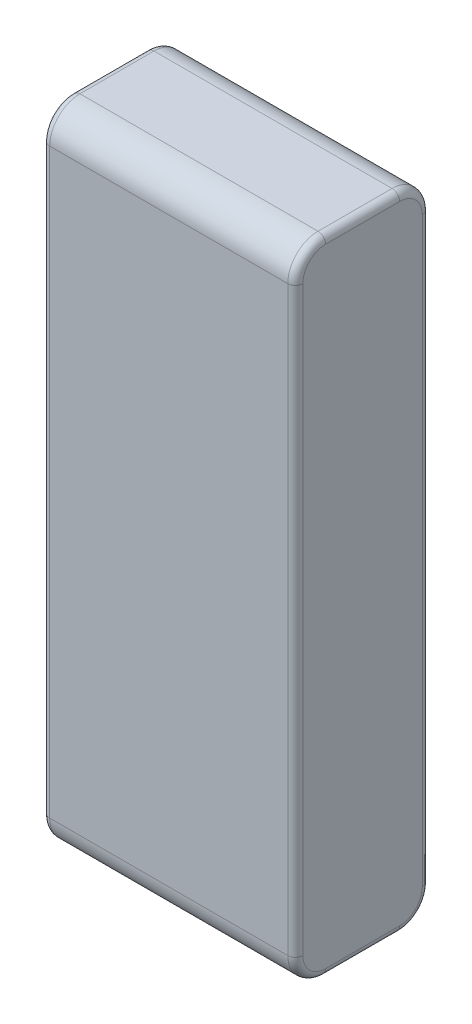
from build123d import *

# Parameters (mm, degrees)
SKETCH1_W           = 33.5
SKETCH1_H           = 85
BOSS_EXTRUDE1_DEPTH = 8.9
FILLET1_R           = 4
FILLET2_R           = 1


with BuildPart() as part:
    # Sketch1 → Boss-Extrude1 (new, symmetric)
    with BuildSketch(Plane.XY):
        Rectangle(SKETCH1_W, SKETCH1_H)
    extrude(amount=BOSS_EXTRUDE1_DEPTH, both=True)

    # Fillet1
    fillet1_edges = [part.edges().sort_by_distance(p)[0] for p in [
        (0, -42.5, 8.9),
        (0, -42.5, -8.9),
        (0, 42.5, -8.9),
        (0, 42.5, 8.9),
    ]]
    fillet(fillet1_edges, radius=FILLET1_R)

    # Fillet2
    fillet2_edges = [part.edges().sort_by_distance(p)[0] for p in [
        (16.75, -42.5, 0),
        (-16.75, -42.5, 0),
        (16.75, 0, -8.9),
        (16.75, 42.5, 0),
        (16.75, 0, 8.9),
        (16.75, 41.328427125, 7.728427125),
        (16.75, 41.328427125, -7.728427125),
        (16.75, -41.328427125, 7.728427125),
        (16.75, -41.328427125, -7.728427125),
        (-16.75, 0, -8.9),
        (-16.75, 0, 8.9),
        (-16.75, 42.5, 0),
        (-16.75, 41.328427125, 7.728427125),
        (-16.75, 41.328427125, -7.728427125),
        (-16.75, -41.328427125, 7.728427125),
        (-16.75, -41.328427125, -7.728427125),
    ]]
    fillet(fillet2_edges, radius=FILLET2_R)


solid = part.part
